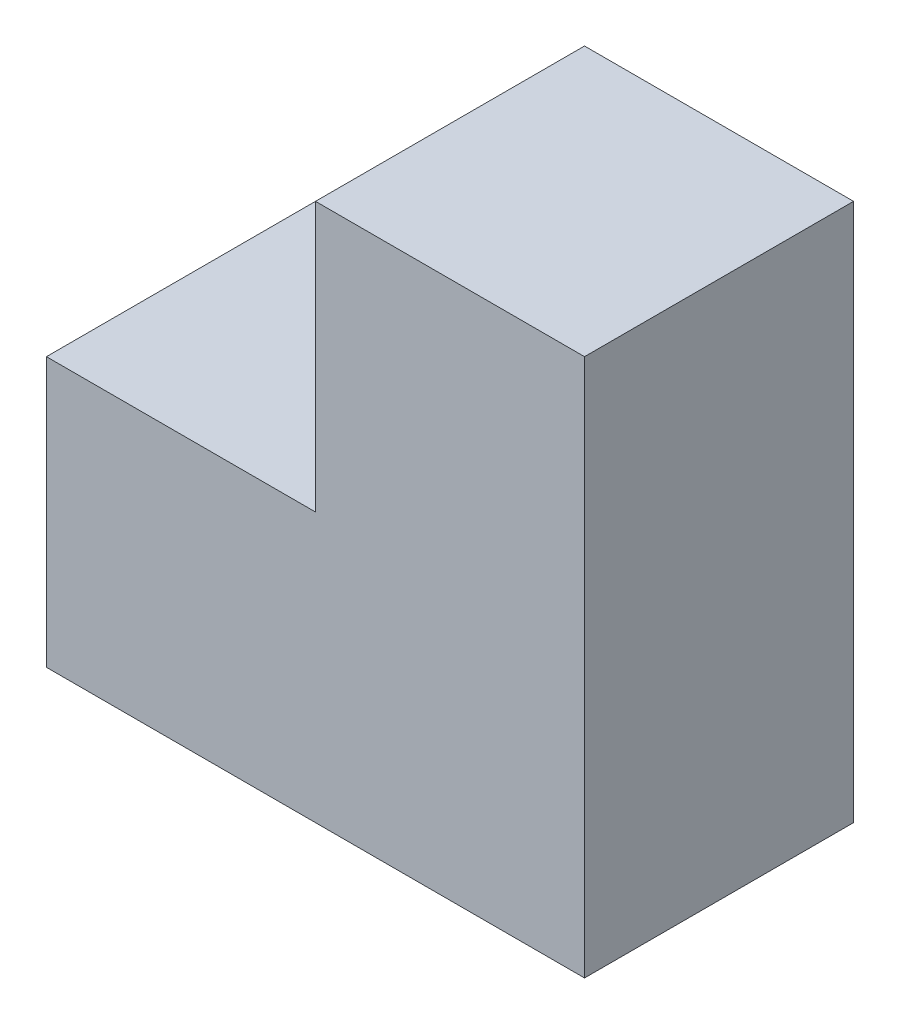
from build123d import *

# Parameters (mm, degrees)
BOSS_EXTRUDE1_DEPTH = 19.05


with BuildPart() as part:
    # Sketch1 → Boss-Extrude1 (new body)
    with BuildSketch(Plane.XY):
        Polygon((0, 0), (38.1, 0), (38.1, 38.1), (19.05, 38.1), (19.05, 19.05), (0, 19.05), align=None)
    extrude(amount=BOSS_EXTRUDE1_DEPTH)


solid = part.part
